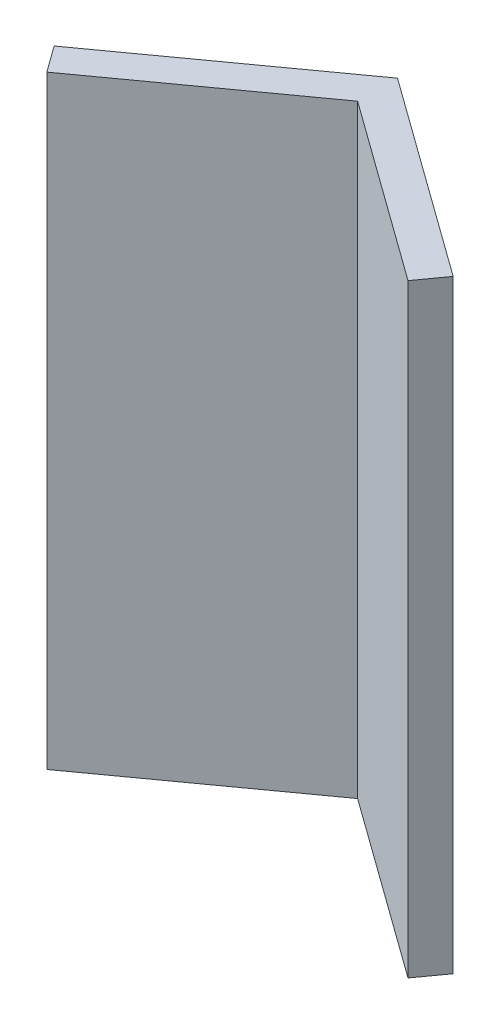
from build123d import *

# Parameters (mm, degrees)
BOSS_EXTRUDE1_DEPTH      = 43.5
BOSS_EXTRUDE1_DEPTH_BACK = 12.5


with BuildPart() as part:
    # Sketch1 → Boss-Extrude1 (new, two sides: drawn at the far end of the back side and taken through both)
    with BuildSketch(Plane(origin=(0, 31.453737586, 0), x_dir=(1, 0, 0), z_dir=(0, 1, 0)).offset(-BOSS_EXTRUDE1_DEPTH_BACK)):
        Polygon((-1.945011046, -163.383168224), (14.80066627, -151.311561121), (31.546343586, -163.383168224), (33.30066627, -160.949579944), (14.80066627, -147.61331846), (-3.69933373, -160.949579944), align=None)
    extrude(amount=BOSS_EXTRUDE1_DEPTH + BOSS_EXTRUDE1_DEPTH_BACK)


solid = part.part
